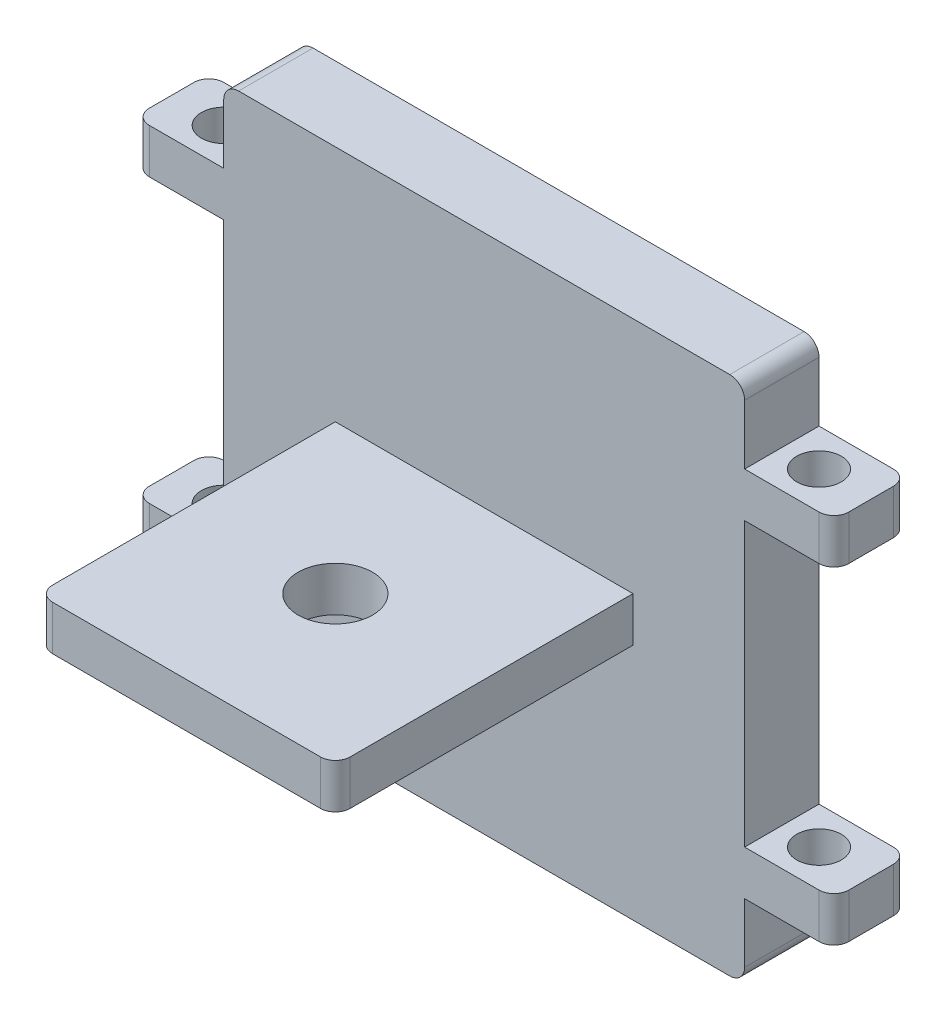
from build123d import *

# Parameters (mm, degrees)
SKETCH1_W                = 35
SKETCH1_H                = 35
BOSS_EXTRUDE2_DEPTH      = 5
BOSS_EXTRUDE3_DEPTH      = 6
BOSS_EXTRUDE3_DEPTH_BACK = 41
SKETCH2_W                = 5
SKETCH2_H                = 3
FILLET1_R                = 1
F_3_0MM_DOWEL_HOLE1_D    = 3
SKETCH6_W                = 20
SKETCH6_H                = 3
BOSS_EXTRUDE4_DEPTH      = 20
F_5_0MM_DOWEL_HOLE1_D    = 5
FILLET2_R                = 1
FILLET3_R                = 1


with BuildPart() as part:
    # Sketch1 → Boss-Extrude2 (new body)
    with BuildSketch(Plane.XY):
        with Locations((4.15299246, 17.5)):
            Rectangle(SKETCH1_W, SKETCH1_H)
    extrude(amount=BOSS_EXTRUDE2_DEPTH)

    # Sketch2 → Boss-Extrude3 (add, two sides: drawn at the far end of the back side and taken through both)
    with BuildSketch(Plane(origin=(21.65299246, 0, 0), x_dir=(0, 0, -1), z_dir=(1, 0, 0)).offset(-BOSS_EXTRUDE3_DEPTH_BACK)):
        with Locations((-2.5, 28.5)):
            Rectangle(SKETCH2_W, SKETCH2_H)
        with Locations((-2.5, 6.5)):
            Rectangle(SKETCH2_W, SKETCH2_H)
    extrude(amount=BOSS_EXTRUDE3_DEPTH + BOSS_EXTRUDE3_DEPTH_BACK)

    # Fillet1
    fillet1_edges = [part.edges().sort_by_distance(p)[0] for p in [
        (-19.34700754, 28.5, 5),
        (-19.34700754, 28.5, 0),
        (27.65299246, 28.5, 5),
        (27.65299246, 28.5, 0),
        (-19.34700754, 6.5, 5),
        (-19.34700754, 6.5, 0),
        (27.65299246, 6.5, 5),
        (27.65299246, 6.5, 0),
    ]]
    fillet(fillet1_edges, radius=FILLET1_R)

    # Ø3.0mm Dowel Hole1 (through all)
    with Locations(Plane.XZ):
        with Locations((24.15299246, 2.5), (-15.84700754, 2.5)):
            Hole(F_3_0MM_DOWEL_HOLE1_D / 2)

    # Sketch6 → Boss-Extrude4 (add)
    with BuildSketch(Plane.XY.offset(5)):
        with Locations((4.15299246, 17.5)):
            Rectangle(SKETCH6_W, SKETCH6_H)
    extrude(amount=BOSS_EXTRUDE4_DEPTH)

    # Ø5.0mm Dowel Hole1 (through all)
    with Locations(Plane.XZ):
        with Locations((4.15299246, 15)):
            Hole(F_5_0MM_DOWEL_HOLE1_D / 2)

    # Fillet2
    fillet2_edges = [part.edges().sort_by_distance(p)[0] for p in [
        (-5.84700754, 17.5, 25),
        (14.15299246, 17.5, 25),
    ]]
    fillet(fillet2_edges, radius=FILLET2_R)

    # Fillet3
    fillet3_edges = [part.edges().sort_by_distance(p)[0] for p in [
        (21.65299246, 0, 2.5),
        (-13.34700754, 0, 2.5),
        (-13.34700754, 35, 2.5),
        (21.65299246, 35, 2.5),
    ]]
    fillet(fillet3_edges, radius=FILLET3_R)


solid = part.part
